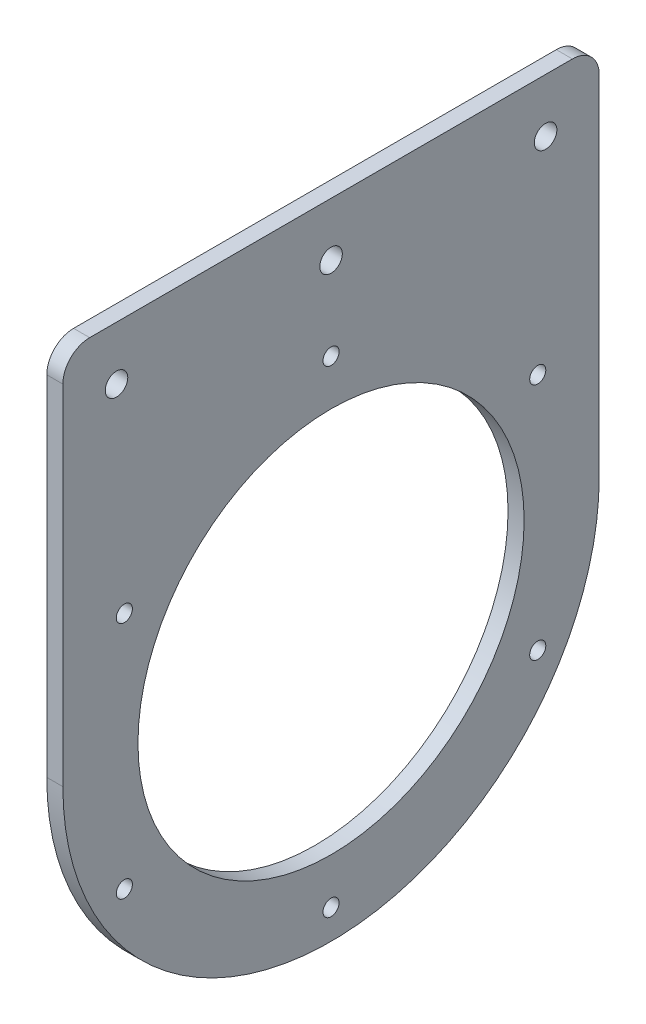
from build123d import *

# Parameters (mm, degrees)
SKETCH_1_R          = 50
SKETCH_1_R_2        = 36
EXTRUDE_1_DEPTH     = 3
EXTRUDE_START       = -3
EXTRUDE_2_DEPTH     = 3
SKETCH_3_R          = 1.5
CUT_EXTRUDE_1_DEPTH = 3
SKETCH_4_R          = 2.1
CUT_EXTRUDE_2_DEPTH = 87.075548212
FILLET_2_R          = 5


with BuildPart() as part:
    # 草图1 → 凸台-拉伸1 (new body)
    with BuildSketch(Plane(origin=(0, 0, 0), x_dir=(0, 0, -1), z_dir=(1, 0, 0))):
        Circle(SKETCH_1_R)
        Circle(SKETCH_1_R_2, mode=Mode.SUBTRACT)
    extrude(amount=EXTRUDE_1_DEPTH)

    # 草图2 → 凸台-拉伸2 (add)
    with BuildSketch(Plane(origin=(3, 0, 0), x_dir=(0, 0, -1), z_dir=(1, 0, 0)).offset(EXTRUDE_START)):
        with BuildLine():
            Line((-50, 0), (-50, 70))
            Line((-50, 70), (50, 70))
            Line((50, 70), (50, 0))
            ThreePointArc((50, 0), (0, 50), (-50, 0))
        make_face()
    extrude(amount=EXTRUDE_2_DEPTH)

    # 草图3 → 切除-拉伸1 (cut)
    with BuildSketch(Plane(origin=(3, 0, 0), x_dir=(0, 0, -1), z_dir=(1, 0, 0))):
        with Locations((0, 44.5)):
            Circle(SKETCH_3_R)
        with Locations((38.538130468, 22.25)):
            Circle(SKETCH_3_R)
        with Locations((38.538130468, -22.25)):
            Circle(SKETCH_3_R)
        with Locations((0, -44.5)):
            Circle(SKETCH_3_R)
        with Locations((-38.538130468, -22.25)):
            Circle(SKETCH_3_R)
        with Locations((-38.538130468, 22.25)):
            Circle(SKETCH_3_R)
    extrude(amount=-CUT_EXTRUDE_1_DEPTH, mode=Mode.SUBTRACT)

    # 草图4 → 切除-拉伸2 (cut, through all)
    with BuildSketch(Plane(origin=(3, 0, 0), x_dir=(0, 0, -1), z_dir=(1, 0, 0))):
        with Locations((-40, 60)):
            Circle(SKETCH_4_R)
        with Locations((0, 60)):
            Circle(SKETCH_4_R)
        with Locations((40, 60)):
            Circle(SKETCH_4_R)
    extrude(amount=-CUT_EXTRUDE_2_DEPTH, mode=Mode.SUBTRACT)

    # 圆角2
    fillet_2_edges = [part.edges().sort_by_distance(p)[0] for p in [
        (1.5, 70, 50),
        (1.5, 70, -50),
    ]]
    fillet(fillet_2_edges, radius=FILLET_2_R)


solid = part.part
